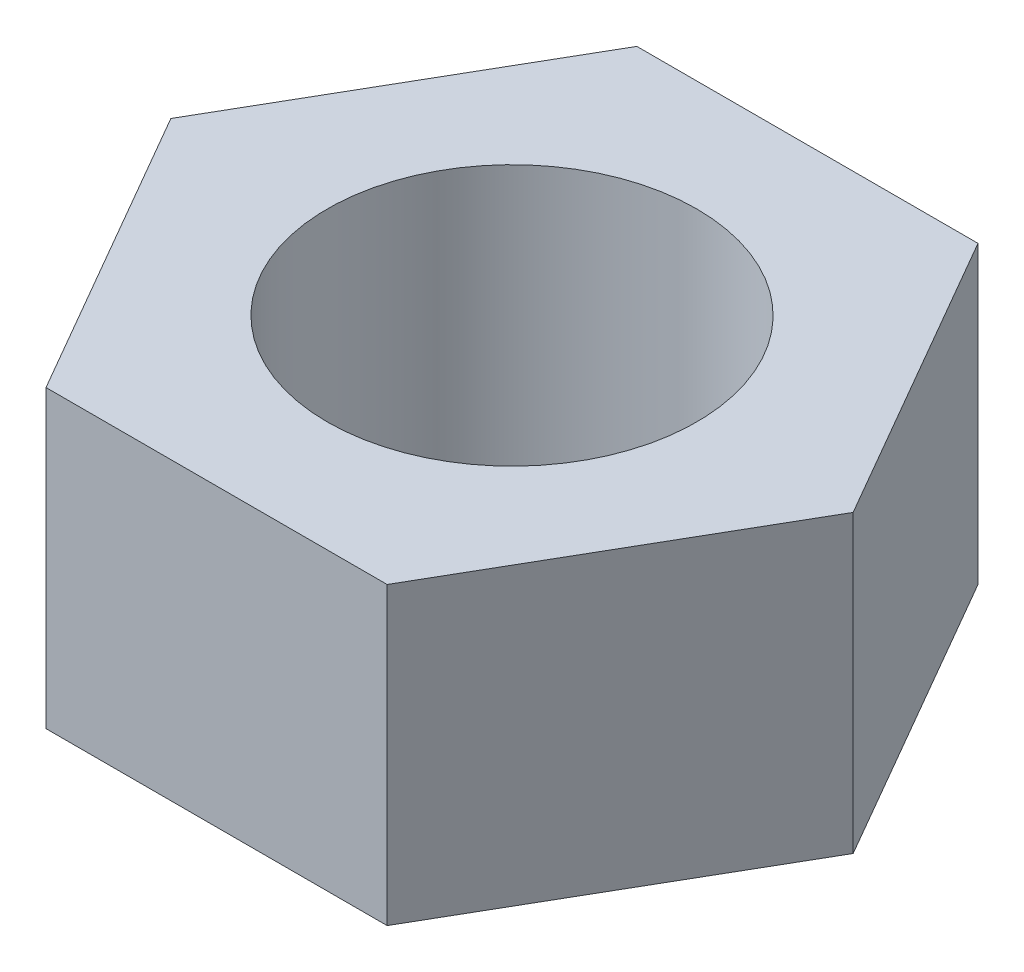
from build123d import *

# Parameters (mm, degrees)
SKETCH1_R           = 2.5
BOSS_EXTRUDE1_DEPTH = 4


with BuildPart() as part:
    # Sketch1 → Boss-Extrude1 (new body)
    with BuildSketch(Plane(origin=(0, 0, 0), x_dir=(1, 0, 0), z_dir=(0, 1, 0))):
        Polygon((-2.309401077, -4), (2.309401077, -4), (4.618802154, 0), (2.309401077, 4), (-2.309401077, 4), (-4.618802154, 0), align=None)
        with Locations(Location((0, 0, 0), (0, 0, 270))):
            Circle(SKETCH1_R, mode=Mode.SUBTRACT)
    extrude(amount=BOSS_EXTRUDE1_DEPTH)


solid = part.part
